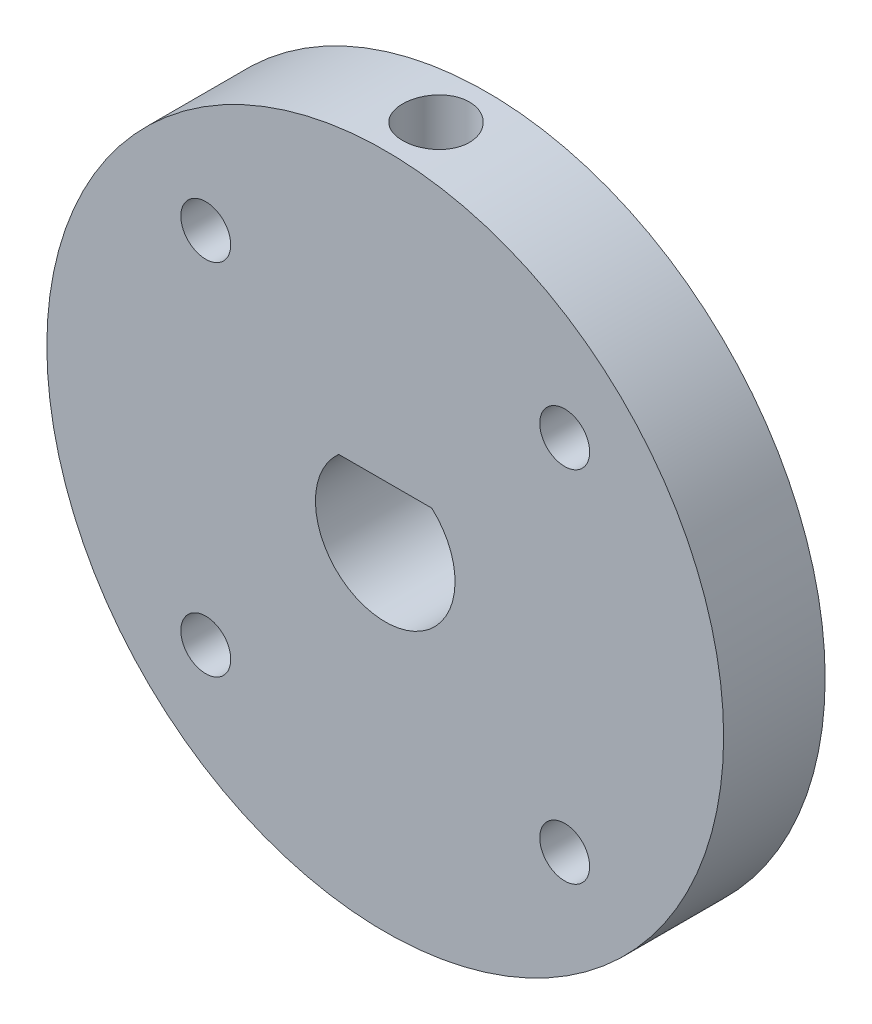
from build123d import *

# Parameters (mm, degrees)
SKETCH1_R               = 20
SKETCH1_R_2             = 1.475
BOSS_EXTRUDE1_DEPTH     = 6
CUT_EXTRUDE1_REACH      = 30.914
CUT_EXTRUDE1_END_RADIUS = 20
SKETCH2_R               = 1.975


with BuildPart() as part:
    # Sketch1 → Boss-Extrude1 (new body)
    # profile 1 of 2: a face of its own
    with BuildSketch(Plane.XY):
        Circle(SKETCH1_R)
        with Locations((-10.606601718, -10.606601718)):
            Circle(SKETCH1_R_2, mode=Mode.SUBTRACT)
        with Locations((10.606601718, -10.606601718)):
            Circle(SKETCH1_R_2, mode=Mode.SUBTRACT)
        with Locations((-10.606601718, 10.606601718)):
            Circle(SKETCH1_R_2, mode=Mode.SUBTRACT)
        with BuildLine():
            ThreePointArc((4.125, 0), (-1.684302549, -3.765468088), (-2.749545417, 3.075))
            ThreePointArc((-2.749545417, 3.075), (0, 4.125), (2.749545417, 3.075))
            ThreePointArc((2.749545417, 3.075), (3.765468088, 1.684302549), (4.125, 0))
        make_face(mode=Mode.SUBTRACT)
        with Locations((10.606601718, 10.606601718)):
            Circle(SKETCH1_R_2, mode=Mode.SUBTRACT)
    # profile 2 of 2: a face of its own
    with BuildSketch(Plane.XY):
        with BuildLine():
            ThreePointArc((2.749545417, 3.075), (0, 4.125), (-2.749545417, 3.075))
            Line((-2.749545417, 3.075), (2.749545417, 3.075))
        make_face()
    extrude(amount=BOSS_EXTRUDE1_DEPTH)

    # Cut-Extrude1: up to this cylinder (the profile starts inside it)
    cut_extrude1_end = Plane(origin=(0, 0, 3), z_dir=(0, 0, -1)) * Cylinder(CUT_EXTRUDE1_END_RADIUS, 102.828, mode=Mode.PRIVATE)
    # Sketch2 → Cut-Extrude1 (cut, up to the surface)
    with BuildSketch(Plane(origin=(0, 0, 0), x_dir=(1, 0, 0), z_dir=(0, 1, 0)), mode=Mode.PRIVATE) as cut_extrude1_sk1:
        with Locations(Location((0, -3, 0), (0, 0, 90))):
            Circle(SKETCH2_R)
    cut_extrude1_tool1 = extrude(cut_extrude1_sk1.sketch, amount=CUT_EXTRUDE1_REACH, mode=Mode.PRIVATE) & cut_extrude1_end
    add(cut_extrude1_tool1.solids().sort_by_distance((0, 0, 3))[0], mode=Mode.SUBTRACT)


solid = part.part
